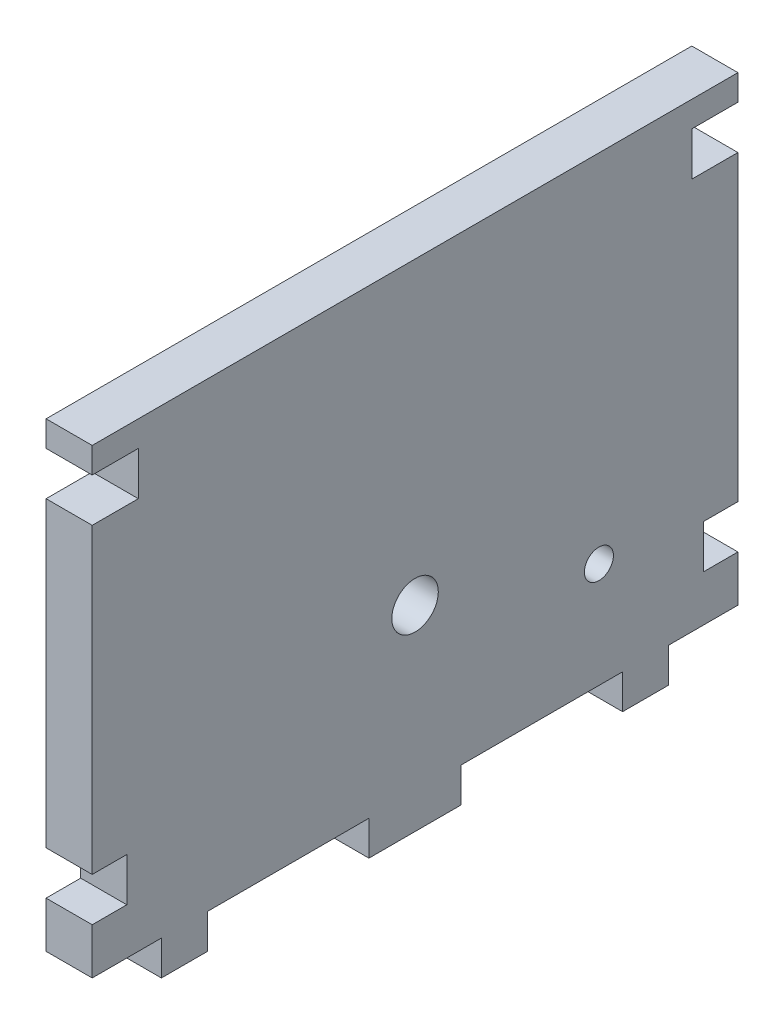
from build123d import *

# Parameters (mm, degrees)
SKETCH1_R           = 2
SKETCH1_R_2         = 3.2004
BOSS_EXTRUDE1_DEPTH = 6.35


with BuildPart() as part:
    # Sketch1 → Boss-Extrude1 (new body)
    with BuildSketch(Plane(origin=(0, 0, 0), x_dir=(0, 0, -1), z_dir=(1, 0, 0))):
        Polygon((28.575, -22.225), (28.575, -26.9875), (34.925, -26.9875), (34.925, -22.225), (44.45, -22.225), (44.45, -15.875), (39.6875, -15.875), (39.6875, -9.8806), (44.45, -9.8806), (44.45, 31.75), (38.1, 31.75), (38.1, 37.7444), (44.45, 37.7444), (44.45, 41.275), (-44.45, 41.275), (-44.45, 37.7444), (-38.1, 37.7444), (-38.1, 31.75), (-44.45, 31.75), (-44.45, 22.225), (-44.45, -9.8806), (-39.6875, -9.8806), (-39.6875, -15.875), (-44.45, -15.875), (-44.45, -22.225), (-34.925, -22.225), (-34.925, -26.9875), (-28.575, -26.9875), (-28.575, -22.225), (-6.35, -22.225), (-6.35, -26.9875), (6.35, -26.9875), (6.35, -22.225), align=None)
        with Locations((25.309068, -7.724902)):
            Circle(SKETCH1_R, mode=Mode.SUBTRACT)
        Circle(SKETCH1_R_2, mode=Mode.SUBTRACT)
    extrude(amount=BOSS_EXTRUDE1_DEPTH)


solid = part.part
